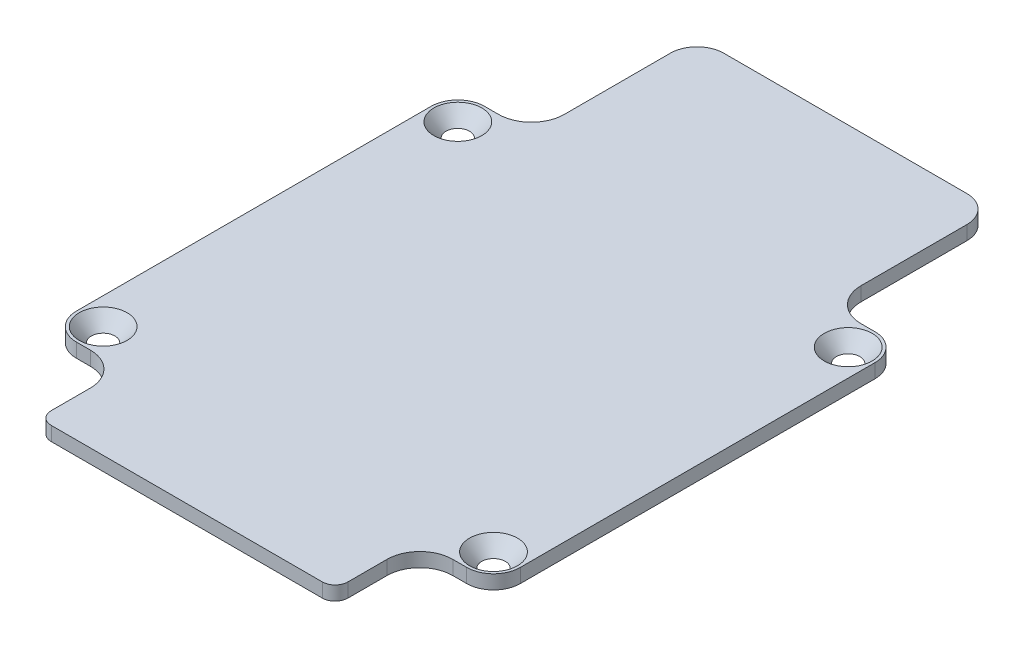
from build123d import *

# Parameters (mm, degrees)
BOSS_EXTRUDE3_DEPTH                            = 1.6
CSK_FOR_2_FLAT_HEAD_MACHINE_SCREW1_D           = 2.4384
CSK_FOR_2_FLAT_HEAD_MACHINE_SCREW1_DEPTH       = 5.588
CSK_FOR_2_FLAT_HEAD_MACHINE_SCREW1_CSINK_D     = 5.461
CSK_FOR_2_FLAT_HEAD_MACHINE_SCREW1_CSINK_ANGLE = 82
CSK_FOR_2_FLAT_HEAD_MACHINE_SCREW1_TIP         = 0.732569267


with BuildPart() as part:
    # Sketch1 → Boss-Extrude3 (new body)
    with BuildSketch(Plane(origin=(0, 9.525, 0), x_dir=(1, 0, 0), z_dir=(0, 1, 0))):
        with BuildLine():
            Line((-16.891, 39.0525), (-16.891, 26.9875))
            ThreePointArc((-16.891, 26.9875), (-17.988324444, 24.338324444), (-20.6375, 23.241))
            Line((-20.6375, 23.241), (-22.225, 23.241))
            ThreePointArc((-22.225, 23.241), (-24.380261469, 22.348261469), (-25.273, 20.193))
            Line((-25.273, 20.193), (-25.273, -20.193))
            ThreePointArc((-25.273, -20.193), (-24.380261469, -22.348261469), (-22.225, -23.241))
            Line((-22.225, -23.241), (-20.6375, -23.241))
            ThreePointArc((-20.6375, -23.241), (-17.988324444, -24.338324444), (-16.891, -26.9875))
            Line((-16.891, -26.9875), (-16.891, -31.4325))
            ThreePointArc((-16.891, -31.4325), (-16.463229454, -32.465229454), (-15.4305, -32.893))
            Line((-15.4305, -32.893), (15.4305, -32.893))
            ThreePointArc((15.4305, -32.893), (16.463229454, -32.465229454), (16.891, -31.4325))
            Line((16.891, -31.4325), (16.891, -26.9875))
            ThreePointArc((16.891, -26.9875), (17.988324444, -24.338324444), (20.6375, -23.241))
            Line((20.6375, -23.241), (22.225, -23.241))
            ThreePointArc((22.225, -23.241), (24.380261469, -22.348261469), (25.273, -20.193))
            Line((25.273, -20.193), (25.273, 20.193))
            ThreePointArc((25.273, 20.193), (24.380261469, 22.348261469), (22.225, 23.241))
            Line((22.225, 23.241), (20.6375, 23.241))
            ThreePointArc((20.6375, 23.241), (17.988324444, 24.338324444), (16.891, 26.9875))
            Line((16.891, 26.9875), (16.891, 39.0525))
            ThreePointArc((16.891, 39.0525), (15.998261469, 41.207761469), (13.843, 42.1005))
            Line((13.843, 42.1005), (-13.843, 42.1005))
            ThreePointArc((-13.843, 42.1005), (-15.998261469, 41.207761469), (-16.891, 39.0525))
        make_face()
    extrude(amount=-BOSS_EXTRUDE3_DEPTH)

    # CSK for #2 Flat Head Machine Screw1
    with Locations(Plane(origin=(22.225, 9.525, 20.193), x_dir=(0, 0, 1), z_dir=(0, 1, 0))):
        with Locations((0, 0), (0, -44.45), (-40.386, -44.45), (-40.386, 0)):
            CounterSinkHole(CSK_FOR_2_FLAT_HEAD_MACHINE_SCREW1_D / 2, CSK_FOR_2_FLAT_HEAD_MACHINE_SCREW1_CSINK_D / 2, depth=CSK_FOR_2_FLAT_HEAD_MACHINE_SCREW1_DEPTH, counter_sink_angle=CSK_FOR_2_FLAT_HEAD_MACHINE_SCREW1_CSINK_ANGLE)
            with Locations((0, 0, -(CSK_FOR_2_FLAT_HEAD_MACHINE_SCREW1_DEPTH + CSK_FOR_2_FLAT_HEAD_MACHINE_SCREW1_TIP / 2))):  # 118° drill point
                Cone(0, CSK_FOR_2_FLAT_HEAD_MACHINE_SCREW1_D / 2, CSK_FOR_2_FLAT_HEAD_MACHINE_SCREW1_TIP, mode=Mode.SUBTRACT)


solid = part.part
